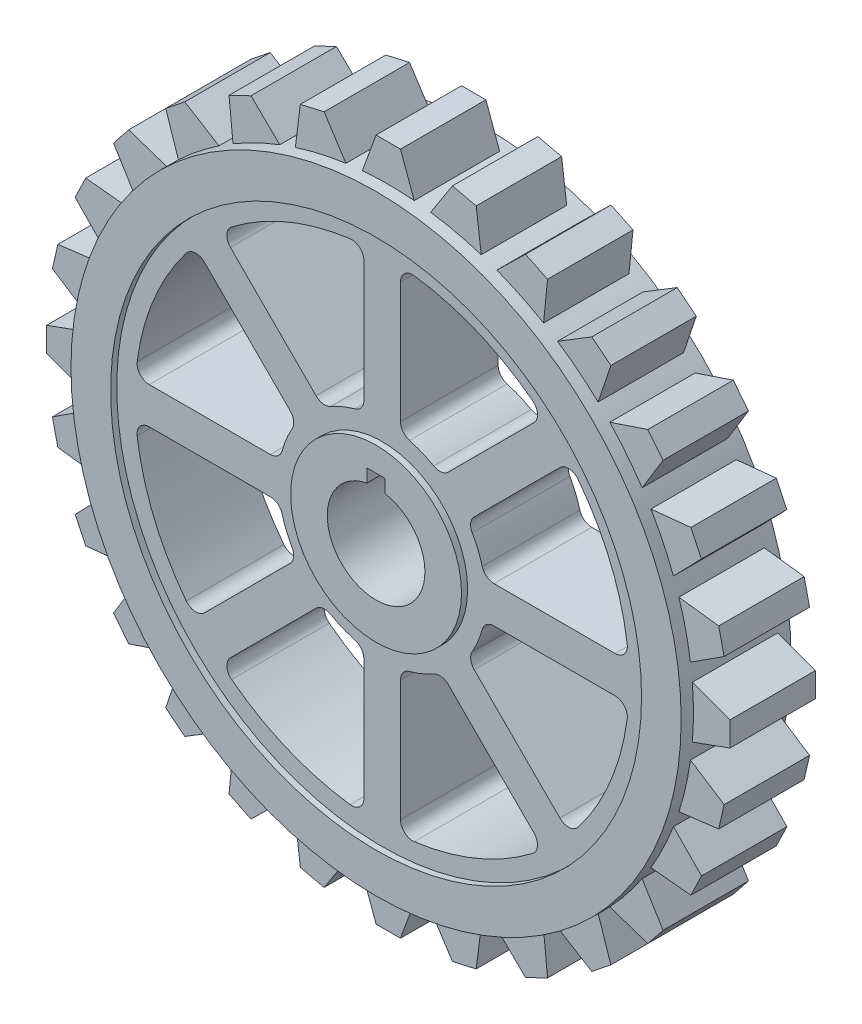
from build123d import *

# Parameters (mm, degrees)
SKETCH1_R             = 50
SKETCH1_R_2           = 43.5
BOSS_EXTRUDE1_DEPTH   = 9
SKETCH1_R_3           = 14
BOSS_EXTRUDE1_2_DEPTH = 9
SKETCH1_4_R           = 43.5
SKETCH1_4_R_2         = 14
BOSS_EXTRUDE2_DEPTH   = 8
BOSS_EXTRUDE3_DEPTH   = 7
CIRPATTERN1_COUNT     = 28


with BuildPart() as part:
    # Sketch1 → Boss-Extrude1 (new, symmetric)
    with BuildSketch(Plane.XY):
        Circle(SKETCH1_R)
        Circle(SKETCH1_R_2, mode=Mode.SUBTRACT)
    extrude(amount=BOSS_EXTRUDE1_DEPTH, both=True)



with BuildPart() as body_2:
    # Sketch1 → Boss-Extrude1 2 (new, symmetric)
    with BuildSketch(Plane.XY):
        Circle(SKETCH1_R_3)
        with BuildLine():
            ThreePointArc((1.5, 7.858116823), (0, -8), (-1.5, 7.858116823))
            Line((-1.5, 7.858116823), (-1.5, 10))
            Line((-1.5, 10), (1.5, 10))
            Line((1.5, 10), (1.5, 7.858116823))
        make_face(mode=Mode.SUBTRACT)
    extrude(amount=BOSS_EXTRUDE1_2_DEPTH, both=True)


with BuildPart() as part_1:
    add(part.part)

    add(body_2.part)  # Boss-Extrude2 merges body 2
    # Sketch1<4> → Boss-Extrude2 (add, symmetric)
    with BuildSketch(Plane.XY):
        Circle(SKETCH1_4_R)
        with BuildLine():
            ThreePointArc((-24.676093263, -32.114489273), (-25.45328177, -30.658734542), (-24.871734319, -29.114375006))
            Line((-24.871734319, -29.114375006), (-10.840161053, -15.08280174))
            ThreePointArc((-10.840161053, -15.08280174), (-9.69145539, -14.514717254), (-8.433742492, -14.760487376))
            ThreePointArc((-8.433742492, -14.760487376), (-6.50561835, -15.705952053), (-4.473684211, -16.400797224))
            ThreePointArc((-4.473684211, -16.400797224), (-3.410561172, -17.116348822), (-3, -18.33030278))
            Line((-3, -18.33030278), (-3, -38.173943993))
            ThreePointArc((-3, -38.173943993), (-3.680810954, -39.67718724), (-5.25974026, -40.157006019))
            ThreePointArc((-5.25974026, -40.157006019), (-15.498679011, -37.417121067), (-24.676093263, -32.114489273))
        make_face(mode=Mode.SUBTRACT)
        with BuildLine():
            ThreePointArc((-40.157006019, -5.25974026), (-39.67718724, -3.680810954), (-38.173943993, -3))
            Line((-38.173943993, -3), (-18.33030278, -3))
            ThreePointArc((-18.33030278, -3), (-17.116348822, -3.410561172), (-16.400797224, -4.473684211))
            ThreePointArc((-16.400797224, -4.473684211), (-15.705952053, -6.50561835), (-14.760487376, -8.433742492))
            ThreePointArc((-14.760487376, -8.433742492), (-14.514717254, -9.69145539), (-15.08280174, -10.840161053))
            Line((-15.08280174, -10.840161053), (-29.114375006, -24.871734319))
            ThreePointArc((-29.114375006, -24.871734319), (-30.658734542, -25.45328177), (-32.114489273, -24.676093263))
            ThreePointArc((-32.114489273, -24.676093263), (-37.417121067, -15.498679011), (-40.157006019, -5.25974026))
        make_face(mode=Mode.SUBTRACT)
        with BuildLine():
            ThreePointArc((5.25974026, -40.157006019), (3.680810954, -39.67718724), (3, -38.173943993))
            Line((3, -38.173943993), (3, -18.33030278))
            ThreePointArc((3, -18.33030278), (3.410561172, -17.116348822), (4.473684211, -16.400797224))
            ThreePointArc((4.473684211, -16.400797224), (6.50561835, -15.705952053), (8.433742492, -14.760487376))
            ThreePointArc((8.433742492, -14.760487376), (9.69145539, -14.514717254), (10.840161053, -15.08280174))
            Line((10.840161053, -15.08280174), (24.871734319, -29.114375006))
            ThreePointArc((24.871734319, -29.114375006), (25.45328177, -30.658734542), (24.676093263, -32.114489273))
            ThreePointArc((24.676093263, -32.114489273), (15.498679011, -37.417121067), (5.25974026, -40.157006019))
        make_face(mode=Mode.SUBTRACT)
        Circle(SKETCH1_4_R_2, mode=Mode.SUBTRACT)
        with BuildLine():
            ThreePointArc((32.114489273, -24.676093263), (30.658734542, -25.45328177), (29.114375006, -24.871734319))
            Line((29.114375006, -24.871734319), (15.08280174, -10.840161053))
            ThreePointArc((15.08280174, -10.840161053), (14.514717254, -9.69145539), (14.760487376, -8.433742492))
            ThreePointArc((14.760487376, -8.433742492), (15.705952053, -6.50561835), (16.400797224, -4.473684211))
            ThreePointArc((16.400797224, -4.473684211), (17.116348822, -3.410561172), (18.33030278, -3))
            Line((18.33030278, -3), (38.173943993, -3))
            ThreePointArc((38.173943993, -3), (39.67718724, -3.680810954), (40.157006019, -5.25974026))
            ThreePointArc((40.157006019, -5.25974026), (37.417121067, -15.498679011), (32.114489273, -24.676093263))
        make_face(mode=Mode.SUBTRACT)
        with BuildLine():
            ThreePointArc((-32.114489273, 24.676093263), (-30.658734542, 25.45328177), (-29.114375006, 24.871734319))
            Line((-29.114375006, 24.871734319), (-15.08280174, 10.840161053))
            ThreePointArc((-15.08280174, 10.840161053), (-14.514717254, 9.69145539), (-14.760487376, 8.433742492))
            ThreePointArc((-14.760487376, 8.433742492), (-15.705952053, 6.50561835), (-16.400797224, 4.473684211))
            ThreePointArc((-16.400797224, 4.473684211), (-17.116348822, 3.410561172), (-18.33030278, 3))
            Line((-18.33030278, 3), (-38.173943993, 3))
            ThreePointArc((-38.173943993, 3), (-39.67718724, 3.680810954), (-40.157006019, 5.25974026))
            ThreePointArc((-40.157006019, 5.25974026), (-37.417121067, 15.498679011), (-32.114489273, 24.676093263))
        make_face(mode=Mode.SUBTRACT)
        with BuildLine():
            ThreePointArc((-5.25974026, 40.157006019), (-3.680810954, 39.67718724), (-3, 38.173943993))
            Line((-3, 38.173943993), (-3, 18.33030278))
            ThreePointArc((-3, 18.33030278), (-3.410561172, 17.116348822), (-4.473684211, 16.400797224))
            ThreePointArc((-4.473684211, 16.400797224), (-6.50561835, 15.705952053), (-8.433742492, 14.760487376))
            ThreePointArc((-8.433742492, 14.760487376), (-9.69145539, 14.514717254), (-10.840161053, 15.08280174))
            Line((-10.840161053, 15.08280174), (-24.871734319, 29.114375006))
            ThreePointArc((-24.871734319, 29.114375006), (-25.45328177, 30.658734542), (-24.676093263, 32.114489273))
            ThreePointArc((-24.676093263, 32.114489273), (-15.498679011, 37.417121067), (-5.25974026, 40.157006019))
        make_face(mode=Mode.SUBTRACT)
        with BuildLine():
            Line((3, 18.33030278), (3, 38.173943993))
            ThreePointArc((3, 38.173943993), (3.680810954, 39.67718724), (5.25974026, 40.157006019))
            ThreePointArc((5.25974026, 40.157006019), (15.498679011, 37.417121067), (24.676093263, 32.114489273))
            ThreePointArc((24.676093263, 32.114489273), (25.45328177, 30.658734542), (24.871734319, 29.114375006))
            Line((24.871734319, 29.114375006), (10.840161053, 15.08280174))
            ThreePointArc((10.840161053, 15.08280174), (9.69145539, 14.514717254), (8.433742492, 14.760487376))
            ThreePointArc((8.433742492, 14.760487376), (6.50561835, 15.705952053), (4.473684211, 16.400797224))
            ThreePointArc((4.473684211, 16.400797224), (3.410561172, 17.116348822), (3, 18.33030278))
        make_face(mode=Mode.SUBTRACT)
        with BuildLine():
            ThreePointArc((40.157006019, 5.25974026), (39.67718724, 3.680810954), (38.173943993, 3))
            Line((38.173943993, 3), (18.33030278, 3))
            ThreePointArc((18.33030278, 3), (17.116348822, 3.410561172), (16.400797224, 4.473684211))
            ThreePointArc((16.400797224, 4.473684211), (15.705952053, 6.50561835), (14.760487376, 8.433742492))
            ThreePointArc((14.760487376, 8.433742492), (14.514717254, 9.69145539), (15.08280174, 10.840161053))
            Line((15.08280174, 10.840161053), (29.114375006, 24.871734319))
            ThreePointArc((29.114375006, 24.871734319), (30.658734542, 25.45328177), (32.114489273, 24.676093263))
            ThreePointArc((32.114489273, 24.676093263), (37.417121067, 15.498679011), (40.157006019, 5.25974026))
        make_face(mode=Mode.SUBTRACT)
    extrude(amount=BOSS_EXTRUDE2_DEPTH, both=True)

    # Sketch1<5> → Boss-Extrude3 (add, symmetric)
    with BuildSketch(Plane.XY):
        with BuildLine():
            Line((-2, 56), (-4.24967254, 49.819075496))
            ThreePointArc((-4.24967254, 49.819075496), (0, 50), (4.24967254, 49.819075496))
            Line((4.24967254, 49.819075496), (2, 56))
            Line((2, 56), (-2, 56))
        make_face()
    boss_extrude3 = extrude(amount=BOSS_EXTRUDE3_DEPTH, both=True)

    # CirPattern1: Boss-Extrude3 ×28 about axis
    cirpattern1_axis = Axis((0, 0, 9), (0, 0, -1))
    for i in range(1, CIRPATTERN1_COUNT):
        add(boss_extrude3.rotate(cirpattern1_axis, i * 360 / CIRPATTERN1_COUNT))


solid = part_1.part
